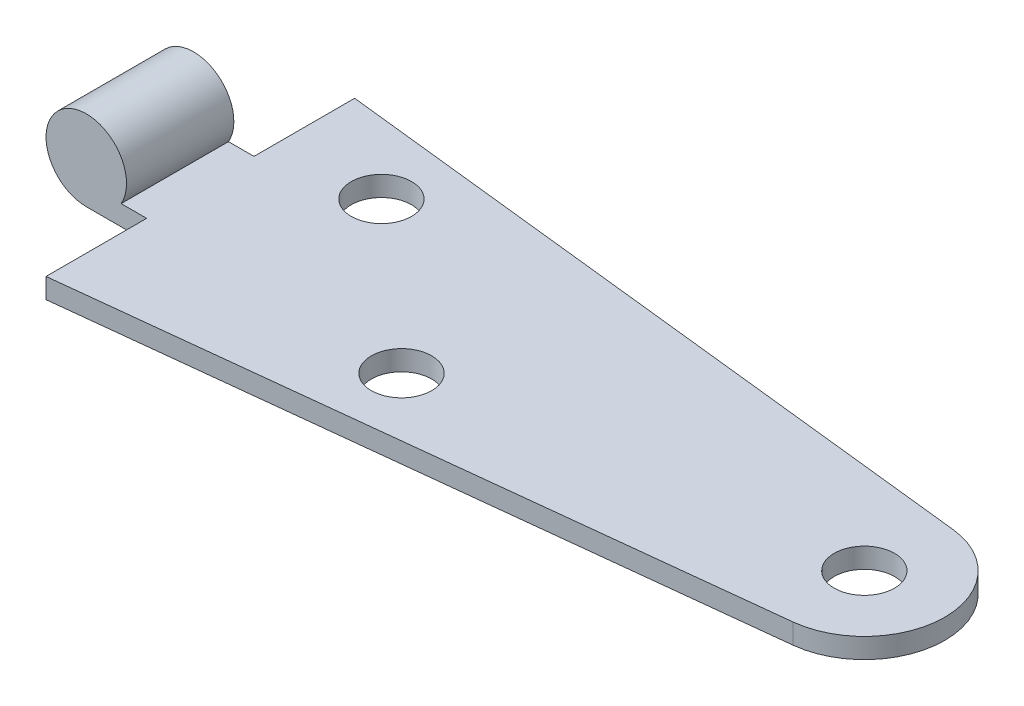
from build123d import *

# Parameters (mm, degrees)
SKETCH1_R               = 2.38125
BOSS_EXTRUDE1_DEPTH     = 1.5875
SKETCH2_W               = 25.4
SKETCH2_H               = 3.175
CUT_EXTRUDE1_DEPTH      = 62.831036149
CUT_EXTRUDE1_DEPTH_BACK = 62.831036149
SKETCH3_W               = 7.9375
SKETCH3_H               = 8.466666667


with BuildPart() as part:
    # Sketch1 → Boss-Extrude1 (new body)
    with BuildSketch(Plane(origin=(0, 0, 0), x_dir=(1, 0, 0), z_dir=(0, 1, 0))):
        with BuildLine():
            Line((-57.15, 12.7), (-57.15, -12.7))
            Line((-57.15, -12.7), (0.697028502, -6.311628258))
            ThreePointArc((0.697028502, -6.311628258), (6.35, 0), (0.697028502, 6.311628258))
            Line((0.697028502, 6.311628258), (-57.15, 12.7))
        make_face()
        with Locations(Location((0, 0, 0), (0, 0, 270))):
            Circle(SKETCH1_R, mode=Mode.SUBTRACT)
        with Locations(Location((-44.45, 6.35, 0), (0, 0, 270))):
            Circle(SKETCH1_R, mode=Mode.SUBTRACT)
        with Locations(Location((-31.75, -4.7625, 0), (0, 0, 270))):
            Circle(SKETCH1_R, mode=Mode.SUBTRACT)
    extrude(amount=BOSS_EXTRUDE1_DEPTH)

    # Sketch2 → Revolve1 (revolve)
    with BuildSketch(Plane.ZY.offset(57.15)):
        with Locations((0, 1.5875)):
            Rectangle(SKETCH2_W, SKETCH2_H)
    revolve(axis=Axis((-57.15, 3.175, -12.7), (0, 0, 1)))

    # Sketch3 → Cut-Extrude1 (cut, two sides: drawn at the far end of the back side and taken through both)
    with BuildSketch(Plane(origin=(0, 1.5875, 0), x_dir=(1, 0, 0), z_dir=(0, 1, 0)).offset(-CUT_EXTRUDE1_DEPTH_BACK)):
        with Locations((-56.35625, 8.466666667)):
            Rectangle(SKETCH3_W, SKETCH3_H)
        with Locations((-56.35625, -8.466666667)):
            Rectangle(SKETCH3_W, SKETCH3_H)
    extrude(amount=CUT_EXTRUDE1_DEPTH + CUT_EXTRUDE1_DEPTH_BACK, mode=Mode.SUBTRACT)


solid = part.part
